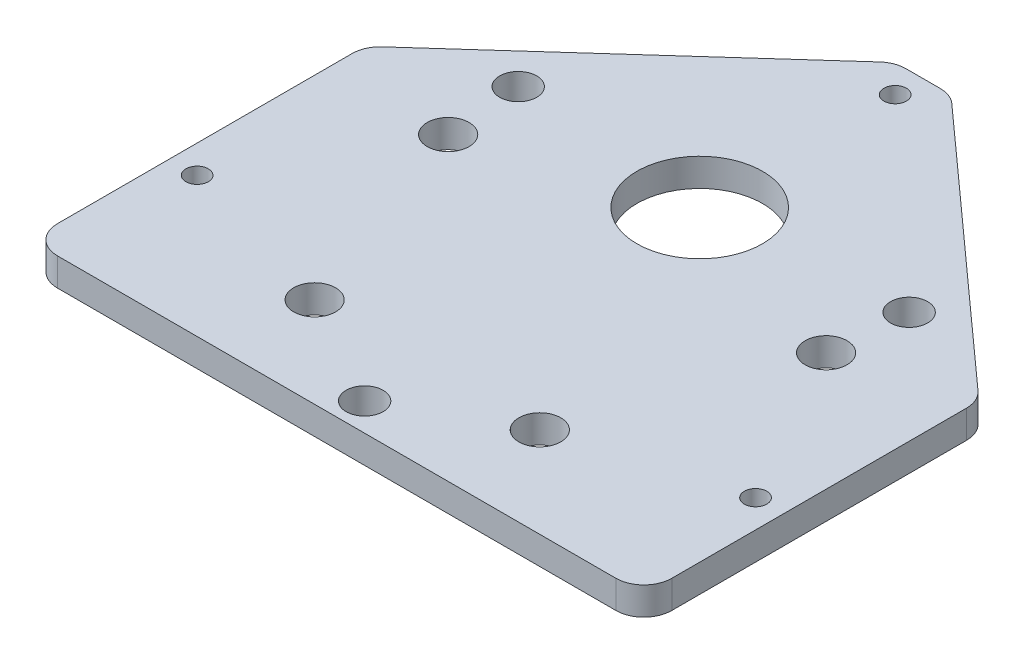
from build123d import *

# Parameters (mm, degrees)
BOSS_EXTRUDE1_DEPTH        = 6.35
SKETCH4_R                  = 14.2875
CUT_EXTRUDE2_DEPTH         = 135.10382172
SKETCH5_R                  = 4.7625
CUT_EXTRUDE3_DEPTH         = 50.8
F_10_CLEARANCE_HOLE1_D     = 5.1054
F_10_CLEARANCE_HOLE1_DEPTH = 50.8
F_10_CLEARANCE_HOLE1_TIP   = 1.533816902
FILLET1_R                  = 6.35
F_5_16_CLEARANCE_HOLE1_D   = 8.4328


with BuildPart() as part:
    # Sketch1 → Boss-Extrude1 (new body)
    with BuildSketch(Plane(origin=(0, 0, 0), x_dir=(1, 0, 0), z_dir=(0, 1, 0))):
        Polygon((-69.85, -19.05), (69.85, -19.05), (69.85, 57.15), (6.35, 114.3), (-6.35, 114.3), (-69.85, 57.15), align=None)
    extrude(amount=BOSS_EXTRUDE1_DEPTH)

    # Sketch4 → Cut-Extrude2 (cut, through all)
    with BuildSketch(Plane(origin=(0, 6.35, 0), x_dir=(1, 0, 0), z_dir=(0, 1, 0))):
        with Locations(Location((0, 63.5, 0), (0, 0, 270))):
            Circle(SKETCH4_R)
    extrude(amount=-CUT_EXTRUDE2_DEPTH, mode=Mode.SUBTRACT)

    # Sketch5 → Cut-Extrude3 (cut)
    with BuildSketch(Plane(origin=(0, 6.35, 19.05), x_dir=(-0.9584281674521108, 0, 0.2853339233851958), z_dir=(0, 1, 0))):
        with Locations(Location((21.697168114, -77.740965053, 0), (0, 0, 73.42119018))):
            Circle(SKETCH5_R)
        with Locations(Location((18.665649821, -27.031499499, 0), (0, 0, 73.42119018))):
            Circle(SKETCH5_R)
        with Locations(Location((-30.411025551, -12.420868461, 0), (0, 0, 73.42119018))):
            Circle(SKETCH5_R)
        with Locations(Location((-60.684163962, -53.21519516, 0), (0, 0, 73.42119018))):
            Circle(SKETCH5_R)
    extrude(amount=-CUT_EXTRUDE3_DEPTH, mode=Mode.SUBTRACT)

    # #10 Clearance Hole1
    with Locations(Plane(origin=(0, 6.35, 19.05), x_dir=(1, 0, 0), z_dir=(0, 1, 0))):
        with Locations((-63.5, 31.75), (63.5, 31.75), (0, 127)):
            Hole(F_10_CLEARANCE_HOLE1_D / 2, depth=F_10_CLEARANCE_HOLE1_DEPTH)
            with Locations((0, 0, -(F_10_CLEARANCE_HOLE1_DEPTH + F_10_CLEARANCE_HOLE1_TIP / 2))):  # 118° drill point
                Cone(0, F_10_CLEARANCE_HOLE1_D / 2, F_10_CLEARANCE_HOLE1_TIP, mode=Mode.SUBTRACT)

    # Fillet1
    fillet1_edges = [part.edges().sort_by_distance(p)[0] for p in [
        (-69.85, 3.175, -57.15),
        (-6.35, 3.175, -114.3),
        (6.35, 3.175, -114.3),
        (69.85, 3.175, -57.15),
        (69.85, 3.175, 19.05),
        (-69.85, 3.175, 19.05),
    ]]
    fillet(fillet1_edges, radius=FILLET1_R)

    # 5/16 Clearance Hole1 (through all)
    with Locations(Plane(origin=(0, 0, 19.05), x_dir=(-1, 0, 0), z_dir=(0, -1, 0))):
        with Locations((-44.45, 85.725), (44.45, 85.725), (0, 6.35)):
            Hole(F_5_16_CLEARANCE_HOLE1_D / 2)


solid = part.part
